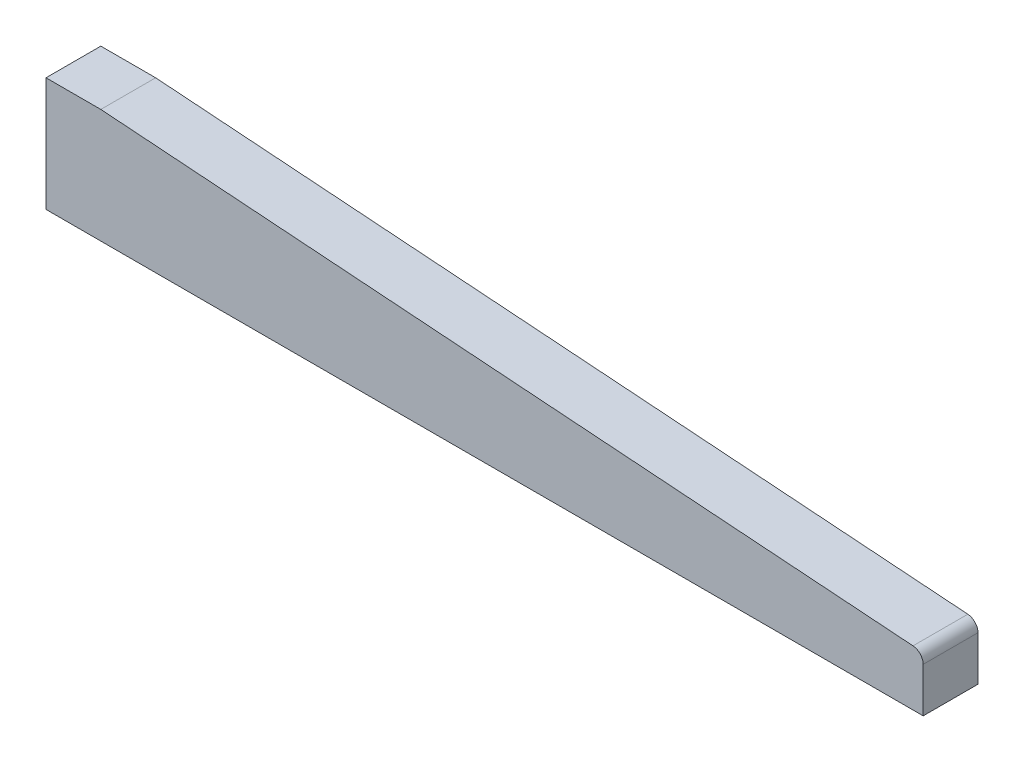
from build123d import *

# Parameters (mm, degrees)
BOSS_EXTRUDE1_DEPTH = 1.5875
FILLET1_R           = 0.635


with BuildPart() as part:
    # Sketch1 → Boss-Extrude1 (new, symmetric)
    with BuildSketch(Plane.XY):
        Polygon((0, 0), (0, 6.604), (3.175, 6.604), (50.8, 3.175), (50.8, 0), align=None)
    extrude(amount=BOSS_EXTRUDE1_DEPTH, both=True)

    # Fillet1
    fillet1_edges = [part.edges().sort_by_distance(p)[0] for p in [
        (50.8, 3.175, 0),
    ]]
    fillet(fillet1_edges, radius=FILLET1_R)


solid = part.part
